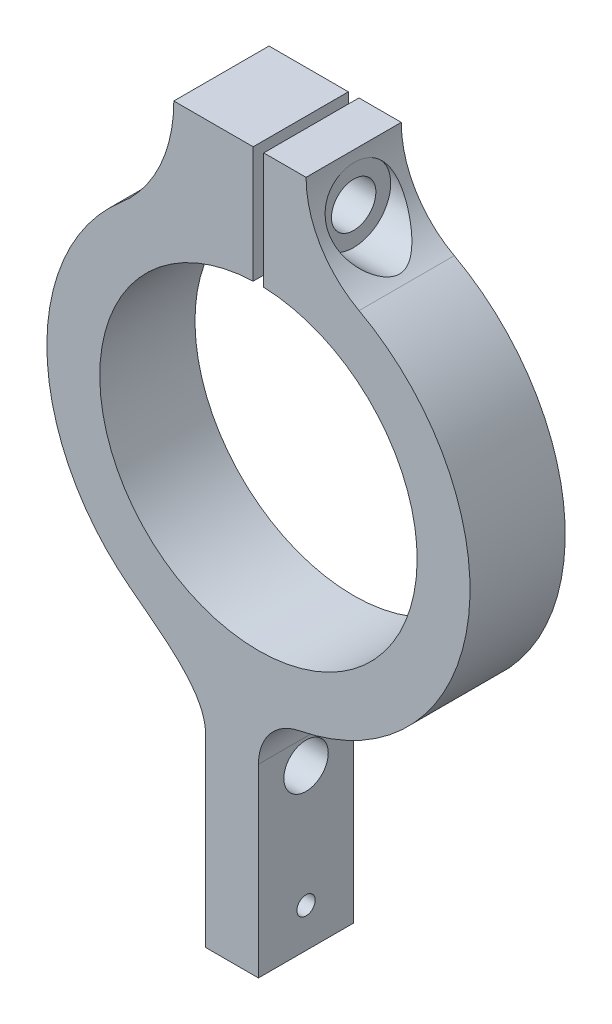
from build123d import *

# Parameters (mm, degrees)
MAIN_BODY_DEPTH       = 18
SKETCH14_W            = 4.2
SKETCH14_H            = 39
M8_CLEARANCE_HOLE2_D  = 8.4
M8_CLEARANCE_HOLE3_D  = 8.4
SKETCH27_R            = 7
CUT_EXTRUDE2_DEPTH    = 99.559772913
F_8_32_TAPPED_HOLE1_D = 3.4544


with BuildPart() as part:
    # Sketch1 → main body (new body)
    with BuildSketch(Plane.XY):
        with BuildLine():
            Line((0, -48.600411521), (0, -83.600411521))
            Line((0, -83.600411521), (-10, -83.600411521))
            Line((-10, -83.600411521), (-10, -48.600411521))
            add(Edge.make_bspline(
                [(-26.535230031, -29.931280748), (-20.948212629, -34.88438627), (-10, -40.904022772), (-10, -48.600411521)],
                knots=[0, 0, 0, 0, 1, 1, 1, 1], degree=3))
            ThreePointArc((-26.535230031, -29.931280748), (-39.998128482, 0.386934068), (-25.951219512, 30.43902439))
            ThreePointArc((-25.951219512, 30.43902439), (-18.607817439, 40.126684972), (-16, 52))
            Line((-16, 52), (-1, 52))
            Line((-1, 52), (-1, 29.983328701))
            ThreePointArc((-1, 29.983328701), (0, -30), (1, 29.983328701))
            Line((1, 29.983328701), (1, 52))
            Line((1, 52), (9, 52))
            ThreePointArc((9, 52), (11.695932832, 42.212959957), (19.02319236, 35.186903138))
            ThreePointArc((19.02319236, 35.186903138), (39.54457484, -6.018853774), (7.693084301, -39.253234949))
            ThreePointArc((7.693084301, -39.253234949), (2.170592409, -42.547452411), (0, -48.600411521))
        make_face()
    extrude(amount=MAIN_BODY_DEPTH)

    # Sketch14 → M8 Clearance Hole1 (revolve, cut)
    with BuildSketch(Plane(origin=(1, 43, 9), x_dir=(0, 0, 1), z_dir=(0, 1, 0))):
        with Locations((2.1, 19.5)):
            Rectangle(SKETCH14_W, SKETCH14_H)
    revolve(axis=Axis((-5.35, 43, 9), (1, 0, 0)), mode=Mode.SUBTRACT)

    # M8 Clearance Hole2 (through all)
    with Locations(Plane(origin=(1, 0, 0), x_dir=(0, 0, 1), z_dir=(1, 0, 0))):
        with Locations((9, -43)):
            Hole(M8_CLEARANCE_HOLE2_D / 2)

    # M8 Clearance Hole3 (through all)
    with Locations(Plane(origin=(0, 0, 0), x_dir=(0, 0, -1), z_dir=(1, 0, 0))):
        with Locations((-9, -53.34)):
            Hole(M8_CLEARANCE_HOLE3_D / 2)

    # Sketch27 → Cut-Extrude2 (cut, through all)
    with BuildSketch(Plane(origin=(9, 0, 0), x_dir=(0, 0, -1), z_dir=(1, 0, 0))):
        with Locations(Location((-9, 43, 0), (0, 0, 270))):
            Circle(SKETCH27_R)
    extrude(amount=CUT_EXTRUDE2_DEPTH, mode=Mode.SUBTRACT)

    # #8-32 Tapped Hole1 (through all)
    with Locations(Plane(origin=(0, 0, 0), x_dir=(0, 0, -1), z_dir=(1, 0, 0))):
        with Locations((-9, -76.2)):
            Hole(F_8_32_TAPPED_HOLE1_D / 2)


solid = part.part
